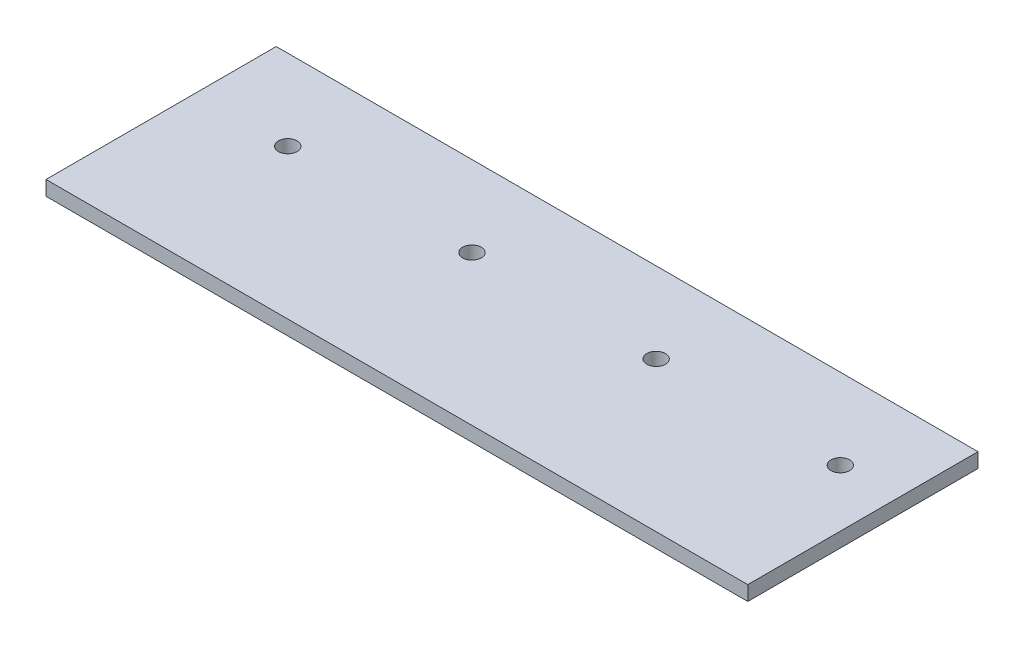
from build123d import *

# Parameters (mm, degrees)
SKETCH1_W           = 304.8
SKETCH1_H           = 100
SKETCH1_R           = 4.05
BOSS_EXTRUDE1_DEPTH = 6.35


with BuildPart() as part:
    # Sketch1 → Boss-Extrude1 (new body)
    with BuildSketch(Plane(origin=(0, 0, 0), x_dir=(1, 0, 0), z_dir=(0, 1, 0))):
        with Locations((152.4, 50)):
            Rectangle(SKETCH1_W, SKETCH1_H)
        with Locations(Location((40, 65, 0), (0, 0, 270))):
            Circle(SKETCH1_R, mode=Mode.SUBTRACT)
        with Locations(Location((120, 65, 0), (0, 0, 270))):
            Circle(SKETCH1_R, mode=Mode.SUBTRACT)
        with Locations(Location((200, 65, 0), (0, 0, 270))):
            Circle(SKETCH1_R, mode=Mode.SUBTRACT)
        with Locations(Location((280, 65, 0), (0, 0, 270))):
            Circle(SKETCH1_R, mode=Mode.SUBTRACT)
    extrude(amount=-BOSS_EXTRUDE1_DEPTH)


solid = part.part
